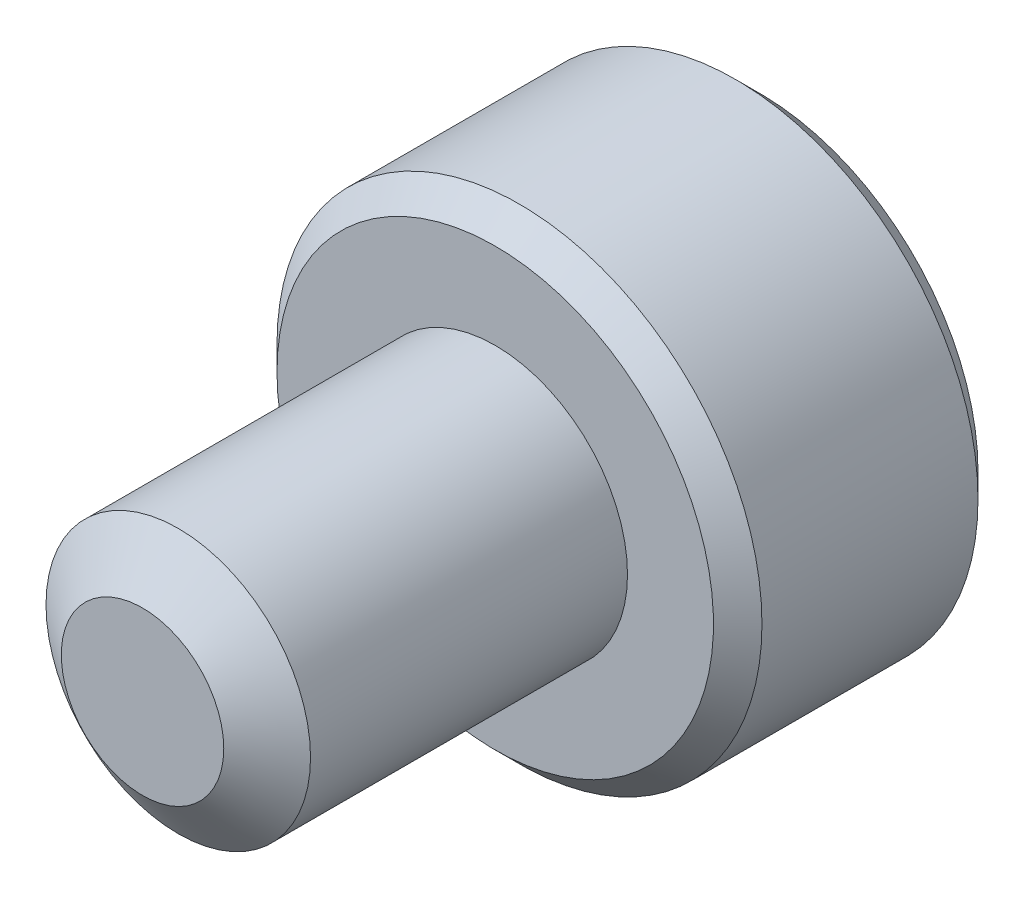
from build123d import *

# Parameters (mm, degrees)
SKETCH1_R          = 1.5
EXTRUDE1_DEPTH     = 4
SKETCH6_R          = 2.75
EXTRUDE2_DEPTH     = 3
CUT_EXTRUDE1_DEPTH = 1.875
CHAMFER1_SIZE      = 0.275


with BuildPart() as part:
    # Sketch1 → Extrude1 (new body)
    with BuildSketch(Plane.XY):
        Circle(SKETCH1_R)
    extrude(amount=-EXTRUDE1_DEPTH)

    # Sketch4 → Cut-Revolve1 (revolve, cut)
    with BuildSketch(Plane(origin=(0, 0, 0), x_dir=(0, 0, -1), z_dir=(1, 0, 0))):
        Polygon((0.405251783, 1.5), (0, 0.921240474), (0, 1.5), align=None)
    revolve(axis=Axis((0, 0, 0), (0, 0, -1)), mode=Mode.SUBTRACT)

    # Sketch6 → Extrude2 (add)
    with BuildSketch(Plane(origin=(0, 0, -4), x_dir=(-1, 0, 0), z_dir=(0, 0, -1))):
        Circle(SKETCH6_R)
    extrude(amount=EXTRUDE2_DEPTH)

    # Sketch7 → Cut-Extrude1 (cut)
    with BuildSketch(Plane(origin=(0, 0, -7), x_dir=(-1, 0, 0), z_dir=(0, 0, -1))):
        Polygon((0, 1.443375673), (-1.25, 0.721687836), (-1.25, -0.721687836), (0, -1.443375673), (1.25, -0.721687836), (1.25, 0.721687836), align=None)
    extrude(amount=-CUT_EXTRUDE1_DEPTH, mode=Mode.SUBTRACT)

    # Cut-Extrude2 cone 1 section (through the dimple's axis) → Cut-Extrude2 (revolve, cut)
    with BuildSketch(Plane(origin=(0, 0, -7), x_dir=(0, 1, 0), z_dir=(1, 0, 0))):
        Polygon((0, 0), (1.443375673, 0), (0, 1.443375673), align=None)
    revolve(axis=Axis((0, 0, -7), (0, 0, 1)), mode=Mode.SUBTRACT)

    # Chamfer1
    chamfer1_edges = [part.edges().sort_by_distance(p)[0] for p in [
        (2.75, 0, -7),
        (2.75, 0, -4),
    ]]
    chamfer(chamfer1_edges, length=CHAMFER1_SIZE)


solid = part.part
